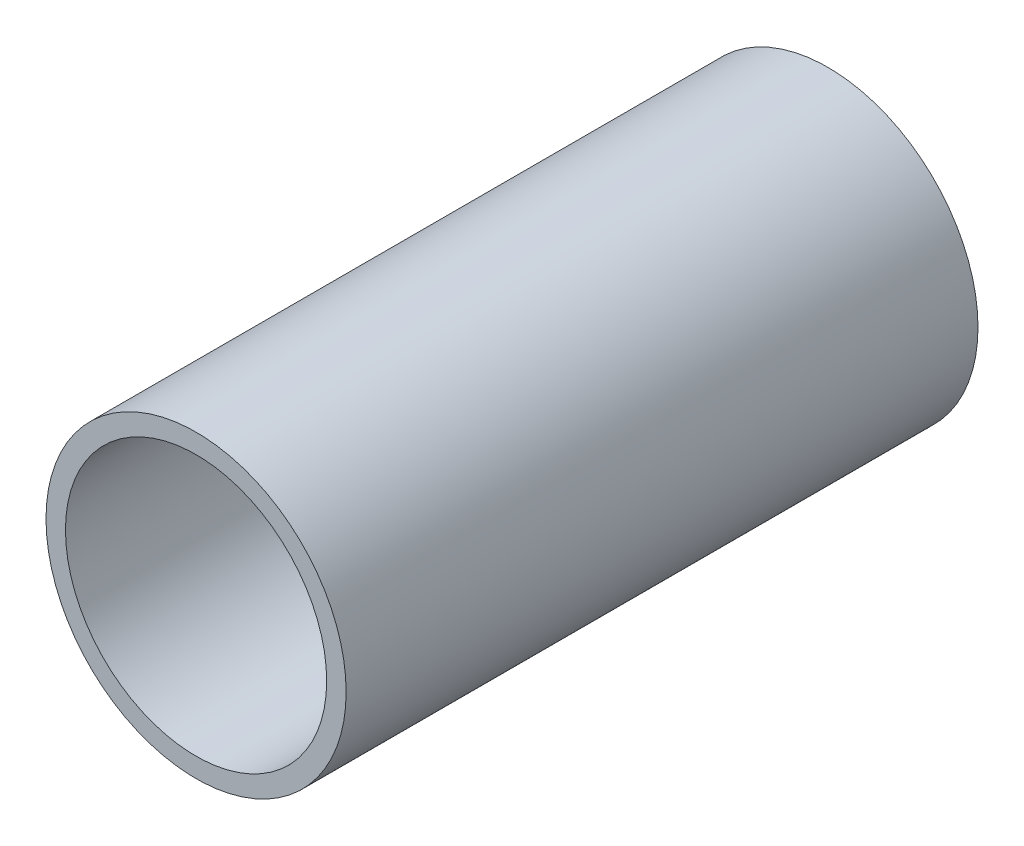
from build123d import *

# Parameters (mm, degrees)
SKETCH1_R           = 30.1625
SKETCH1_R_2         = 26.2509
BOSS_EXTRUDE1_DEPTH = 127


with BuildPart() as part:
    # Sketch1 → Boss-Extrude1 (new body)
    with BuildSketch(Plane.XY):
        Circle(SKETCH1_R)
        Circle(SKETCH1_R_2, mode=Mode.SUBTRACT)
    extrude(amount=BOSS_EXTRUDE1_DEPTH)


solid = part.part
